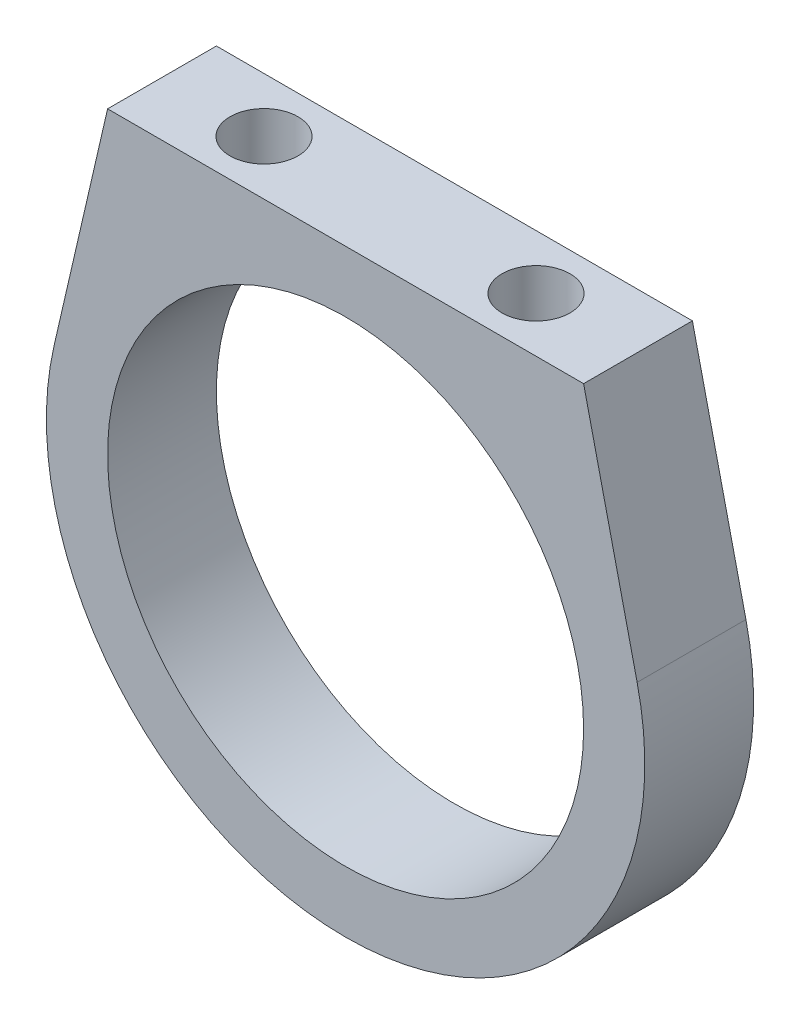
from build123d import *

# Parameters (mm, degrees)
SKETCH1_R                = 8.75
BOSS_EXTRUDE1_DEPTH      = 2
THREADEDHOLES_REACH      = 26.678
THREADEDHOLES_END_RADIUS = 8.75
SKETCH2_R                = 1.25


with BuildPart() as part:
    # Sketch1 → Boss-Extrude1 (new, symmetric)
    with BuildSketch(Plane.XY):
        with BuildLine():
            Line((8.75, 11), (-8.75, 11))
            Line((-8.75, 11), (-10.718127175, 2.47421702))
            ThreePointArc((-10.718127175, 2.47421702), (0, -11), (10.718127175, 2.47421702))
            Line((10.718127175, 2.47421702), (8.75, 11))
        make_face()
        Circle(SKETCH1_R, mode=Mode.SUBTRACT)
    extrude(amount=BOSS_EXTRUDE1_DEPTH, both=True)

    # ThreadedHoles: up to this cylinder (the profile starts outside it)
    threadedholes_end = Plane(origin=(0, 0, 0), z_dir=(0, 0, -1)) * Cylinder(THREADEDHOLES_END_RADIUS, 71.856, mode=Mode.PRIVATE)
    # Sketch2 → ThreadedHoles (cut, up to the surface)
    with BuildSketch(Plane(origin=(0, 11, 0), x_dir=(1, 0, 0), z_dir=(0, 1, 0)), mode=Mode.PRIVATE) as threadedholes_sk1:
        with Locations(Location((-5, 0, 0), (0, 0, 180))):
            Circle(SKETCH2_R)
    threadedholes_tool1 = extrude(threadedholes_sk1.sketch, amount=-THREADEDHOLES_REACH, mode=Mode.PRIVATE) - threadedholes_end
    add(threadedholes_tool1.solids().sort_by_distance((-5, 11, 0))[0], mode=Mode.SUBTRACT)
    # Sketch2 → ThreadedHoles (cut, up to the surface)
    with BuildSketch(Plane(origin=(0, 11, 0), x_dir=(1, 0, 0), z_dir=(0, 1, 0)), mode=Mode.PRIVATE) as threadedholes_sk2:
        with Locations(Location((5, 0, 0), (0, 0, 180))):
            Circle(SKETCH2_R)
    threadedholes_tool2 = extrude(threadedholes_sk2.sketch, amount=-THREADEDHOLES_REACH, mode=Mode.PRIVATE) - threadedholes_end
    add(threadedholes_tool2.solids().sort_by_distance((5, 11, 0))[0], mode=Mode.SUBTRACT)


solid = part.part
